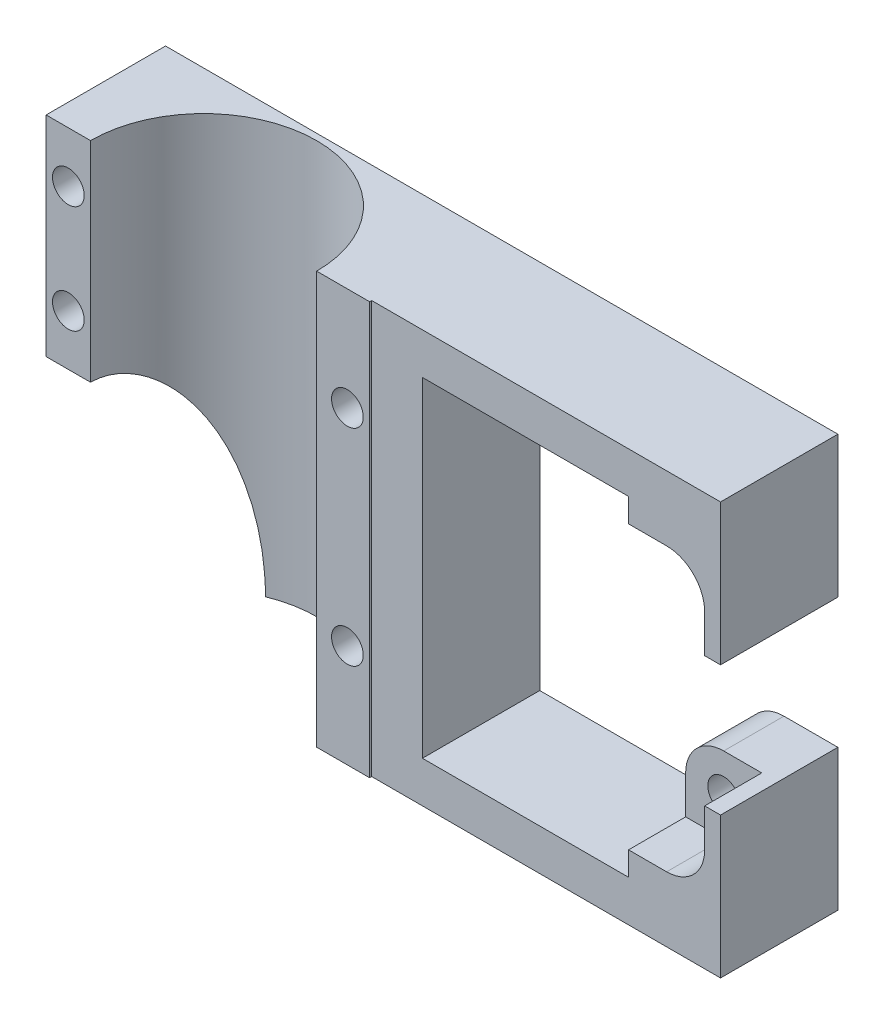
from build123d import *

# Parameters (mm, degrees)
SKETCH1_R           = 2.5
BOSS_EXTRUDE3_DEPTH = 18.5
CUT_EXTRUDE2_START  = -9
CUT_EXTRUDE2_DEPTH  = 9
SKETCH1_5_R         = 2.5
BOSS_EXTRUDE4_DEPTH = 18.825
SKETCH3_R           = 17.825
CUT_EXTRUDE3_DEPTH  = 176.104627652


with BuildPart() as part:
    # Sketch1 → Boss-Extrude3 (new body)
    with BuildSketch(Plane.XY):
        with BuildLine():
            Line((161.5, 32.5), (147, 32.5))
            Line((147, 32.5), (106.5, 32.5))
            Line((106.5, 32.5), (106.5, -32.5))
            Line((106.5, -32.5), (147, -32.5))
            Line((147, -32.5), (161.5, -32.5))
            Line((161.5, -32.5), (161.5, -10.25))
            Line((161.5, -10.25), (153, -10.25))
            ThreePointArc((153, -10.25), (148.757359313, -12.007359313), (147, -16.25))
            Line((147, -16.25), (147, -26))
            Line((147, -26), (114.5, -26))
            Line((114.5, -26), (114.5, 26))
            Line((114.5, 26), (147, 26))
            Line((147, 26), (147, 16.25))
            ThreePointArc((147, 16.25), (148.757359313, 12.007359313), (153, 10.25))
            Line((153, 10.25), (161.5, 10.25))
            Line((161.5, 10.25), (161.5, 32.5))
        make_face()
        with Locations((153, -16.25)):
            Circle(SKETCH1_R, mode=Mode.SUBTRACT)
        with Locations((153, 16.25)):
            Circle(SKETCH1_R, mode=Mode.SUBTRACT)
    extrude(amount=BOSS_EXTRUDE3_DEPTH)

    # Sketch2 → Cut-Extrude2 (cut)
    with BuildSketch(Plane.XY.offset(18.5).offset(CUT_EXTRUDE2_START)):
        with BuildLine():
            Line((153, 22.25), (147, 22.25))
            Line((147, 22.25), (147, 10.25))
            Line((147, 10.25), (159, 10.25))
            Line((159, 10.25), (159, 16.25))
            ThreePointArc((159, 16.25), (157.242640687, 20.492640687), (153, 22.25))
        make_face()
        with BuildLine():
            Line((153, -22.25), (147, -22.25))
            Line((147, -22.25), (147, -10.25))
            Line((147, -10.25), (159, -10.25))
            Line((159, -10.25), (159, -16.25))
            ThreePointArc((159, -16.25), (157.242640687, -20.492640687), (153, -22.25))
        make_face()
    extrude(amount=CUT_EXTRUDE2_DEPTH, mode=Mode.SUBTRACT)

    # Sketch1<5> → Boss-Extrude4 (add)
    with BuildSketch(Plane.XY):
        with BuildLine():
            Line((106.5, -32.5), (106.5, 32.5))
            Line((106.5, 32.5), (55.5, 32.5))
            Line((55.5, 32.5), (55.5, -0.5))
            Line((55.5, -0.5), (62.5, -0.5))
            ThreePointArc((62.5, -0.5), (70.731609419, -15.568030239), (73.58, -32.5))
            Line((73.58, -32.5), (106.5, -32.5))
        make_face()
        with Locations((103, -16.25)):
            Circle(SKETCH1_5_R, mode=Mode.SUBTRACT)
        with Locations((103, 16.25)):
            Circle(SKETCH1_5_R, mode=Mode.SUBTRACT)
        with Locations((59, 24.5)):
            Circle(SKETCH1_5_R, mode=Mode.SUBTRACT)
        with Locations((59, 7.5)):
            Circle(SKETCH1_5_R, mode=Mode.SUBTRACT)
    extrude(amount=BOSS_EXTRUDE4_DEPTH)

    # Sketch3 → Cut-Extrude3 (cut, through all)
    with BuildSketch(Plane.XZ.offset(32.5)):
        with Locations((80.325, 18.825)):
            Circle(SKETCH3_R)
    extrude(amount=-CUT_EXTRUDE3_DEPTH, mode=Mode.SUBTRACT)


solid = part.part
